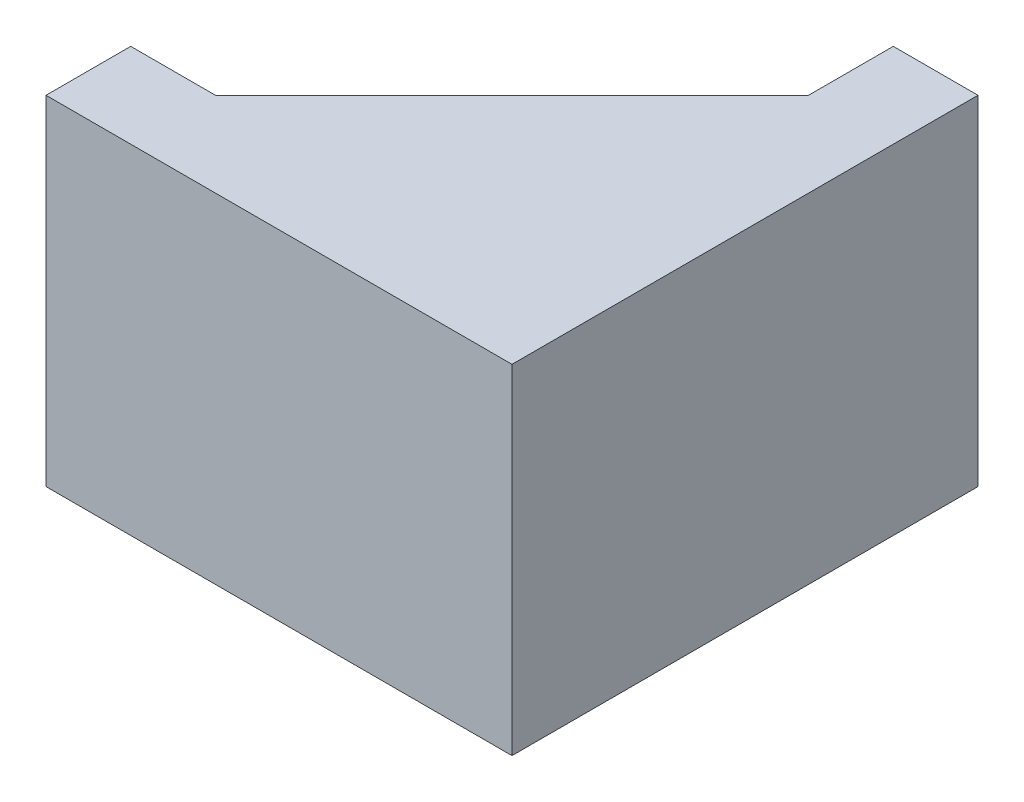
from build123d import *

# Parameters (mm, degrees)
BOSS_EXTRUDE1_DEPTH = 20


with BuildPart() as part:
    # Sketch1 → Boss-Extrude1 (new body)
    with BuildSketch(Plane(origin=(0, 0, 0), x_dir=(1, 0, 0), z_dir=(0, 1, 0))):
        Polygon((0, 0), (-27.5, 0), (-27.5, 5), (-22.5, 5), (-5, 22.5), (-5, 27.5), (0, 27.5), align=None)
    extrude(amount=BOSS_EXTRUDE1_DEPTH)


solid = part.part
